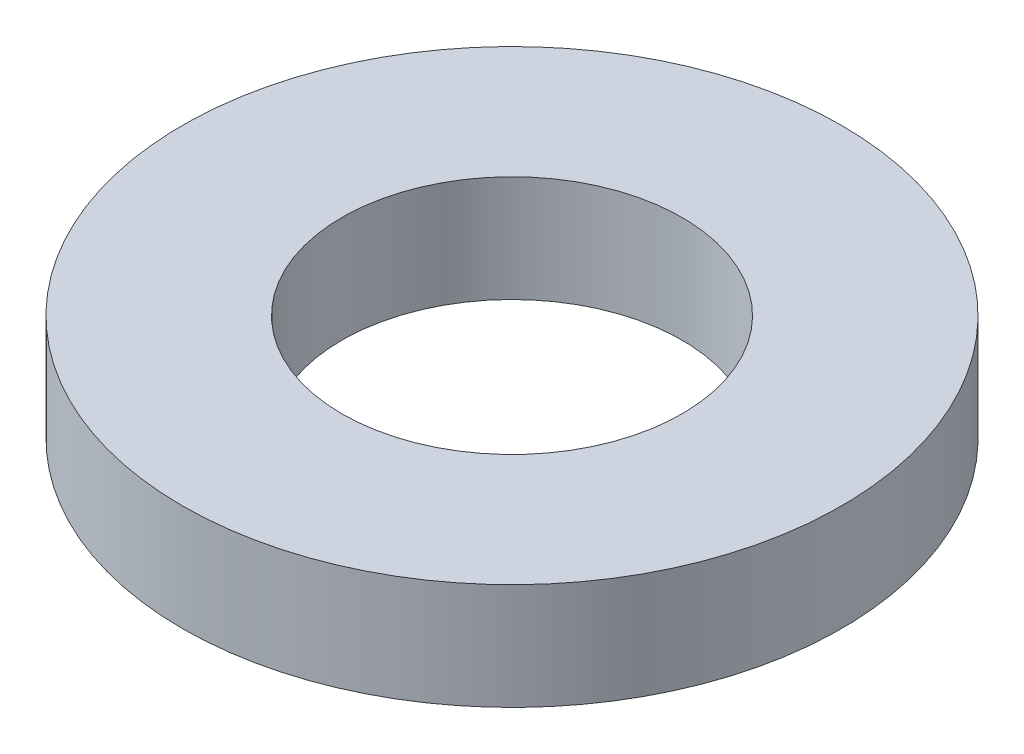
from build123d import *

# Parameters (mm, degrees)
SKETCH_1_R      = 3.1
SKETCH_1_R_2    = 1.6
EXTRUDE_1_DEPTH = 1


with BuildPart() as part:
    # 草图1 → 凸台-拉伸1 (new body)
    with BuildSketch(Plane(origin=(0, 0, 0), x_dir=(1, 0, 0), z_dir=(0, 1, 0))):
        with Locations(Location((0, 0, 0), (0, 0, 270))):
            Circle(SKETCH_1_R)
        with Locations(Location((0, 0, 0), (0, 0, 270))):
            Circle(SKETCH_1_R_2, mode=Mode.SUBTRACT)
    extrude(amount=EXTRUDE_1_DEPTH)


solid = part.part
